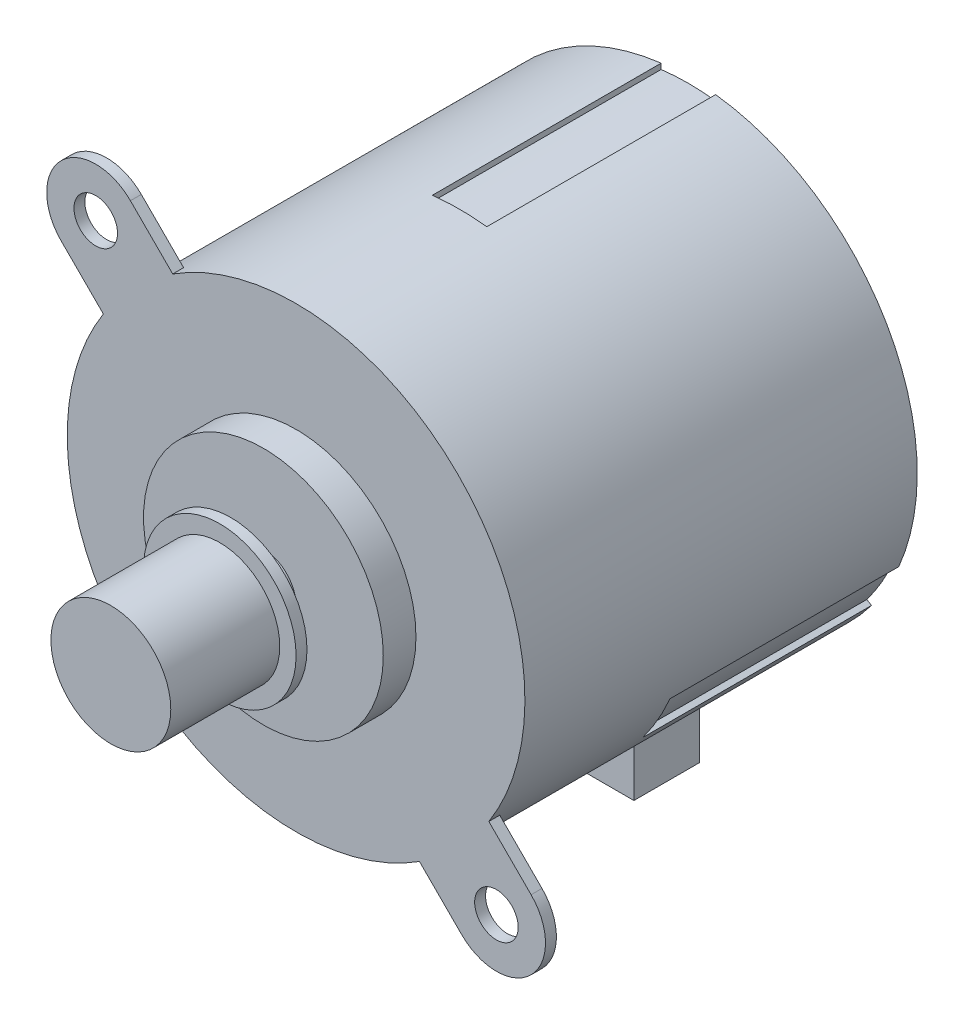
from build123d import *
from build123d.topology import SkipClean

# Parameters (mm, degrees)
SKETCH_1_R          = 21
EXTRUDE_1_DEPTH     = 15
EXTRUDE_START       = 6
EXTRUDE_2_DEPTH     = 6
EXTRUDE_3_DEPTH     = 6
EXTRUDE_START_2     = 9
EXTRUDE_4_DEPTH     = 9
SKETCH_6_R          = 11
EXTRUDE_5_DEPTH     = 3
SKETCH_7_R          = 3
EXTRUDE_6_DEPTH     = 14
EXTRUDE_START_3     = -1
SKETCH_8_R          = 2
EXTRUDE_7_DEPTH     = 1
EXTRUDE_START_4     = -11
SKETCH_9_R          = 7
SKETCH_9_R_2        = 3
EXTRUDE_8_DEPTH     = 11
CUT_EXTRUDE_START   = -10
SKETCH_10_R         = 7
SKETCH_10_R_2       = 5.5
CUT_EXTRUDE_1_DEPTH = 10


with BuildPart() as part:
    # 草图1 → 凸台-拉伸1 (new body)
    with BuildSketch(Plane.XY):
        Circle(SKETCH_1_R)
    extrude(amount=EXTRUDE_1_DEPTH)

    # 草图2 → 凸台-拉伸2 (add)
    with SkipClean():  # the faces are left unmerged after this step: merging them gives an invalid solid
        with BuildSketch(Plane(origin=(0, 0, 0), x_dir=(-1, 0, 0), z_dir=(0, 0, -1)).offset(EXTRUDE_START)):
            with BuildLine():
                Line((2.5, 20.850659462), (2.5, 20.346989949))
                ThreePointArc((2.5, 20.346989949), (0, 20.5), (-2.5, 20.346989949))
                Line((-2.5, 20.346989949), (-2.5, 20.850659462))
                ThreePointArc((-2.5, 20.850659462), (-18.186533479, 10.5), (-19.30720078, -8.260266222))
                Line((-19.30720078, -8.260266222), (-18.871010187, -8.008431465))
                ThreePointArc((-18.871010187, -8.008431465), (-17.753520778, -10.25), (-16.371010187, -12.338558484))
                Line((-16.371010187, -12.338558484), (-16.80720078, -12.59039324))
                ThreePointArc((-16.80720078, -12.59039324), (-15.938440593, -13.673555187), (-15, -14.696938457))
                Line((-15, -14.696938457), (-15, -13.973188612))
                ThreePointArc((-15, -13.973188612), (0, -20.5), (15, -13.973188612))
                Line((15, -13.973188612), (15, -14.696938457))
                ThreePointArc((15, -14.696938457), (15.938440593, -13.673555187), (16.80720078, -12.59039324))
                Line((16.80720078, -12.59039324), (16.371010187, -12.338558484))
                ThreePointArc((16.371010187, -12.338558484), (17.753520778, -10.25), (18.871010187, -8.008431465))
                Line((18.871010187, -8.008431465), (19.30720078, -8.260266222))
                ThreePointArc((19.30720078, -8.260266222), (18.186533479, 10.5), (2.5, 20.850659462))
            make_face()
        extrude(amount=-EXTRUDE_2_DEPTH)

    # 草图4 → 凸台-拉伸3 (add)
    with SkipClean():  # the faces are left unmerged after this step: merging them gives an invalid solid
        with BuildSketch(Plane(origin=(0, 0, -6), x_dir=(-1, 0, 0), z_dir=(0, 0, -1)).offset(EXTRUDE_START)):
            with BuildLine():
                Line((10, -17.895530168), (10, -24))
                Line((10, -24), (-10, -24))
                Line((-10, -24), (-10, -17.895530168))
                ThreePointArc((-10, -17.895530168), (-12.652912345, -16.129284212), (-15, -13.973188612))
                Line((-15, -13.973188612), (-15, -14.696938457))
                ThreePointArc((-15, -14.696938457), (-15.938440593, -13.673555187), (-16.80720078, -12.59039324))
                Line((-16.80720078, -12.59039324), (-16.371010187, -12.338558484))
                ThreePointArc((-16.371010187, -12.338558484), (-17.753520778, -10.25), (-18.871010187, -8.008431465))
                Line((-18.871010187, -8.008431465), (-19.30720078, -8.260266222))
                ThreePointArc((-19.30720078, -8.260266222), (-18.186533479, 10.5), (-2.5, 20.850659462))
                Line((-2.5, 20.850659462), (-2.5, 20.346989949))
                ThreePointArc((-2.5, 20.346989949), (0, 20.5), (2.5, 20.346989949))
                Line((2.5, 20.346989949), (2.5, 20.850659462))
                ThreePointArc((2.5, 20.850659462), (18.186533479, 10.5), (19.30720078, -8.260266222))
                Line((19.30720078, -8.260266222), (18.871010187, -8.008431465))
                ThreePointArc((18.871010187, -8.008431465), (17.753520778, -10.25), (16.371010187, -12.338558484))
                Line((16.371010187, -12.338558484), (16.80720078, -12.59039324))
                ThreePointArc((16.80720078, -12.59039324), (15.938440593, -13.673555187), (15, -14.696938457))
                Line((15, -14.696938457), (15, -13.973188612))
                ThreePointArc((15, -13.973188612), (12.652912345, -16.129284212), (10, -17.895530168))
            make_face()
        extrude(amount=-EXTRUDE_3_DEPTH)

    # 草图5 → 凸台-拉伸4 (add)
    with SkipClean():  # the faces are left unmerged after this step: merging them gives an invalid solid
        with BuildSketch(Plane(origin=(0, 0, -12), x_dir=(-1, 0, 0), z_dir=(0, 0, -1)).offset(EXTRUDE_START_2)):
            with BuildLine():
                Line((18.871010187, -8.008431465), (19.30720078, -8.260266222))
                ThreePointArc((19.30720078, -8.260266222), (18.186533479, 10.5), (2.5, 20.850659462))
                Line((2.5, 20.850659462), (2.5, 20.346989949))
                ThreePointArc((2.5, 20.346989949), (0, 20.5), (-2.5, 20.346989949))
                Line((-2.5, 20.346989949), (-2.5, 20.850659462))
                ThreePointArc((-2.5, 20.850659462), (-18.186533479, 10.5), (-19.30720078, -8.260266222))
                Line((-19.30720078, -8.260266222), (-18.871010187, -8.008431465))
                ThreePointArc((-18.871010187, -8.008431465), (-17.753520778, -10.25), (-16.371010187, -12.338558484))
                Line((-16.371010187, -12.338558484), (-16.80720078, -12.59039324))
                ThreePointArc((-16.80720078, -12.59039324), (-15.938440593, -13.673555187), (-15, -14.696938457))
                ThreePointArc((-15, -14.696938457), (0, -21), (15, -14.696938457))
                ThreePointArc((15, -14.696938457), (15.938440593, -13.673555187), (16.80720078, -12.59039324))
                Line((16.80720078, -12.59039324), (16.371010187, -12.338558484))
                ThreePointArc((16.371010187, -12.338558484), (17.753520778, -10.25), (18.871010187, -8.008431465))
            make_face()
        extrude(amount=-EXTRUDE_4_DEPTH)

    # 草图6 → 凸台-拉伸5 (add)
    with SkipClean():  # the faces are left unmerged after this step: merging them gives an invalid solid
        with BuildSketch(Plane.XY.offset(15)):
            Circle(SKETCH_6_R)
        extrude(amount=EXTRUDE_5_DEPTH)

    # 草图7 → 凸台-拉伸6 (add)
    with SkipClean():  # the faces are left unmerged after this step: merging them gives an invalid solid
        with BuildSketch(Plane.XY.offset(18)):
            Circle(SKETCH_7_R)
        extrude(amount=EXTRUDE_6_DEPTH)

    # 草图8 → 凸台-拉伸7 (add)
    # profile 1 of 2: a face of its own
    with SkipClean():  # the faces are left unmerged after this step: merging them gives an invalid solid
        with BuildSketch(Plane.XY.offset(15).offset(EXTRUDE_START_3)):
            with BuildLine():
                Line((21.566756826, -15.202795796), (17.68629022, -11.322329189))
                ThreePointArc((17.68629022, -11.322329189), (14.849242405, -14.849242405), (11.322329189, -17.68629022))
                Line((11.322329189, -17.68629022), (15.202795796, -21.566756826))
                ThreePointArc((15.202795796, -21.566756826), (21.566756826, -21.566756826), (21.566756826, -15.202795796))
            make_face()
            with Locations((18.384776311, -18.384776311)):
                Circle(SKETCH_8_R, mode=Mode.SUBTRACT)
        # profile 2 of 2: a face of its own
        with BuildSketch(Plane.XY.offset(15).offset(EXTRUDE_START_3)):
            with BuildLine():
                Line((-11.322329189, 17.68629022), (-15.202795796, 21.566756826))
                ThreePointArc((-15.202795796, 21.566756826), (-21.566756826, 21.566756826), (-21.566756826, 15.202795796))
                Line((-21.566756826, 15.202795796), (-17.68629022, 11.322329189))
                ThreePointArc((-17.68629022, 11.322329189), (-14.849242405, 14.849242405), (-11.322329189, 17.68629022))
            make_face()
            with Locations((-18.384776311, 18.384776311)):
                Circle(SKETCH_8_R, mode=Mode.SUBTRACT)
        extrude(amount=EXTRUDE_7_DEPTH)

    # 草图9 → 凸台-拉伸8 (add)
    with SkipClean():  # the faces are left unmerged after this step: merging them gives an invalid solid
        with BuildSketch(Plane.XY.offset(32).offset(EXTRUDE_START_4)):
            Circle(SKETCH_9_R)
            Circle(SKETCH_9_R_2, mode=Mode.SUBTRACT)
        extrude(amount=EXTRUDE_8_DEPTH)

    # 草图10 → 切除-拉伸1 (cut)
    with SkipClean():  # the faces are left unmerged after this step: merging them gives an invalid solid
        with BuildSketch(Plane.XY.offset(32).offset(CUT_EXTRUDE_START)):
            Circle(SKETCH_10_R)
            Circle(SKETCH_10_R_2, mode=Mode.SUBTRACT)
        extrude(amount=CUT_EXTRUDE_1_DEPTH, mode=Mode.SUBTRACT)


solid = part.part
